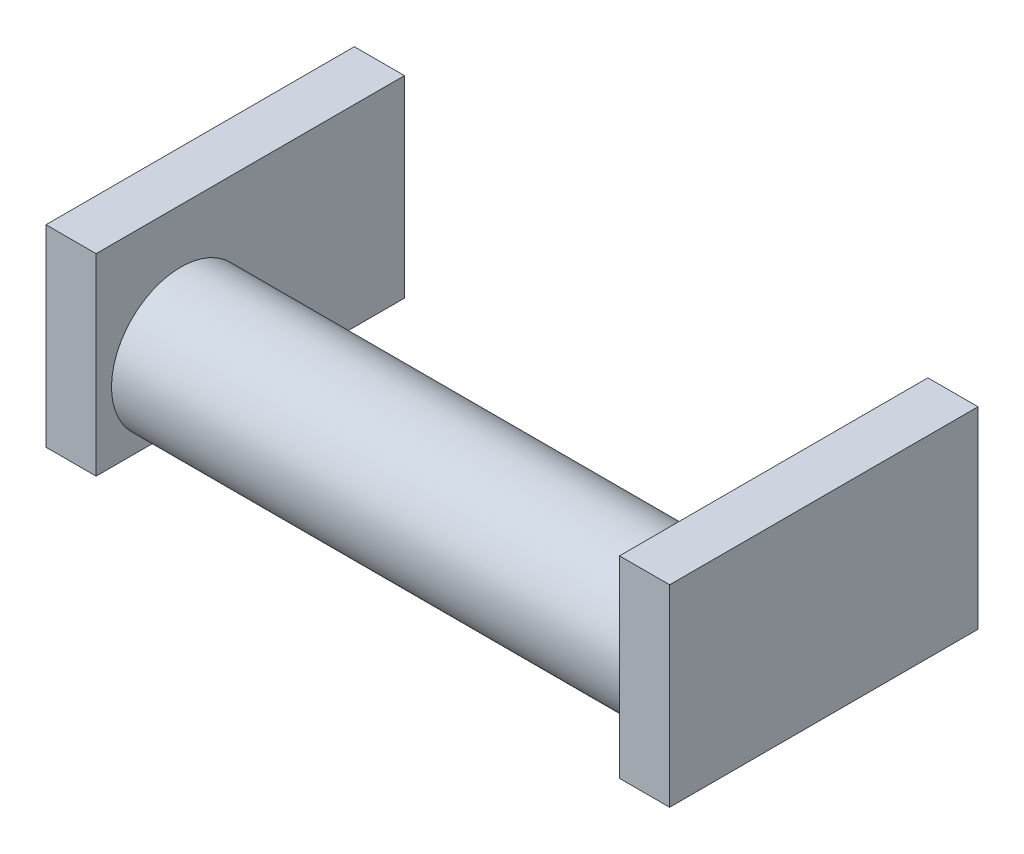
from build123d import *

# Parameters (mm, degrees)
SKETCH1_W           = 6.5
SKETCH1_H           = 25
BOSS_EXTRUDE1_DEPTH = 40
SKETCH2_R           = 1.25
CUT_EXTRUDE1_DEPTH  = 10
SKETCH3_R           = 9
BOSS_EXTRUDE2_DEPTH = 67.9


with BuildPart() as part:
    # Sketch1 → Boss-Extrude1 (new body)
    with BuildSketch(Plane.XY):
        with Locations((-36.95, -62.9)):
            Rectangle(SKETCH1_W, SKETCH1_H)
    boss_extrude1 = extrude(amount=BOSS_EXTRUDE1_DEPTH)

    # Sketch2 → Cut-Extrude1 (cut)
    with BuildSketch(Plane(origin=(0, 0, 0), x_dir=(-1, 0, 0), z_dir=(0, 0, -1))):
        with Locations((37.2, -55.4)):
            Circle(SKETCH2_R)
        with Locations((37.2, -64)):
            Circle(SKETCH2_R)
    cut_extrude1 = extrude(amount=-CUT_EXTRUDE1_DEPTH, mode=Mode.SUBTRACT)

    # Sketch3 → Boss-Extrude2 (add)
    with BuildSketch(Plane(origin=(-33.7, 0, 0), x_dir=(0, 0, -1), z_dir=(1, 0, 0))):
        with Locations(Location((-29, -66.4, 0), (0, 0, 180))):
            Circle(SKETCH3_R)
    extrude(amount=BOSS_EXTRUDE2_DEPTH)

    # Mirror1: Boss-Extrude1, Cut-Extrude1 across plane
    add(boss_extrude1.mirror(Plane(origin=(0.25, 0, 0), x_dir=(0, 0, 1), z_dir=(1, 0, 0))))
    add(cut_extrude1.mirror(Plane(origin=(0.25, 0, 0), x_dir=(0, 0, 1), z_dir=(1, 0, 0))), mode=Mode.SUBTRACT)


solid = part.part
